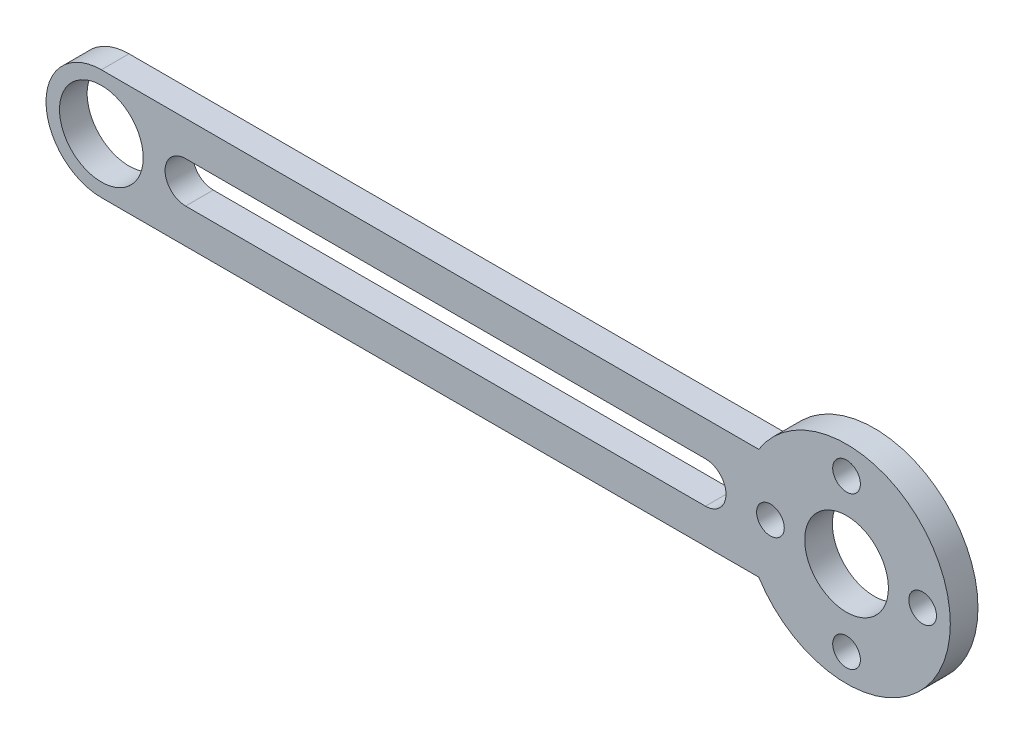
from build123d import *

# Parameters (mm, degrees)
SKETCH_1_R          = 1
SKETCH_1_R_2        = 3.025
SKETCH_1_R_3        = 1.5
EXTRUDE_1_DEPTH     = 2
SKETCH_2_R          = 3.025
CUT_EXTRUDE_1_DEPTH = 10


with BuildPart() as part:
    # 草图1 → 凸台-拉伸1 (new body)
    with BuildSketch(Plane.XY):
        with BuildLine():
            Line((-53.850242828, 4), (-6.34428877, 4))
            ThreePointArc((-6.34428877, 4), (7.5, 0), (-6.34428877, -4))
            Line((-6.34428877, -4), (-53.850242828, -4))
            ThreePointArc((-53.850242828, -4), (-57.850242828, 0), (-53.850242828, 4))
        make_face()
        with Locations((0, 5.5)):
            Circle(SKETCH_1_R, mode=Mode.SUBTRACT)
        with Locations((0, -5.5)):
            Circle(SKETCH_1_R, mode=Mode.SUBTRACT)
        with Locations((-53.850242828, 0)):
            Circle(SKETCH_1_R_2, mode=Mode.SUBTRACT)
        Circle(SKETCH_1_R_3, mode=Mode.SUBTRACT)
        with Locations((-5.5, 0)):
            Circle(SKETCH_1_R, mode=Mode.SUBTRACT)
        with Locations((5.5, 0)):
            Circle(SKETCH_1_R, mode=Mode.SUBTRACT)
        with BuildLine():
            ThreePointArc((-10.194558278, -1.483471582), (-8.711086696, 0), (-10.194558278, 1.483471582))
            Line((-10.194558278, 1.483471582), (-47.761926325, 1.483471582))
            ThreePointArc((-47.761926325, 1.483471582), (-49.245397907, 0), (-47.761926325, -1.483471582))
            Line((-47.761926325, -1.483471582), (-10.194558278, -1.483471582))
        make_face(mode=Mode.SUBTRACT)
    extrude(amount=EXTRUDE_1_DEPTH)

    # 草图2 → 切除-拉伸1 (cut)
    with BuildSketch(Plane.XY.offset(2)):
        Circle(SKETCH_2_R)
    extrude(amount=-CUT_EXTRUDE_1_DEPTH, mode=Mode.SUBTRACT)


solid = part.part
